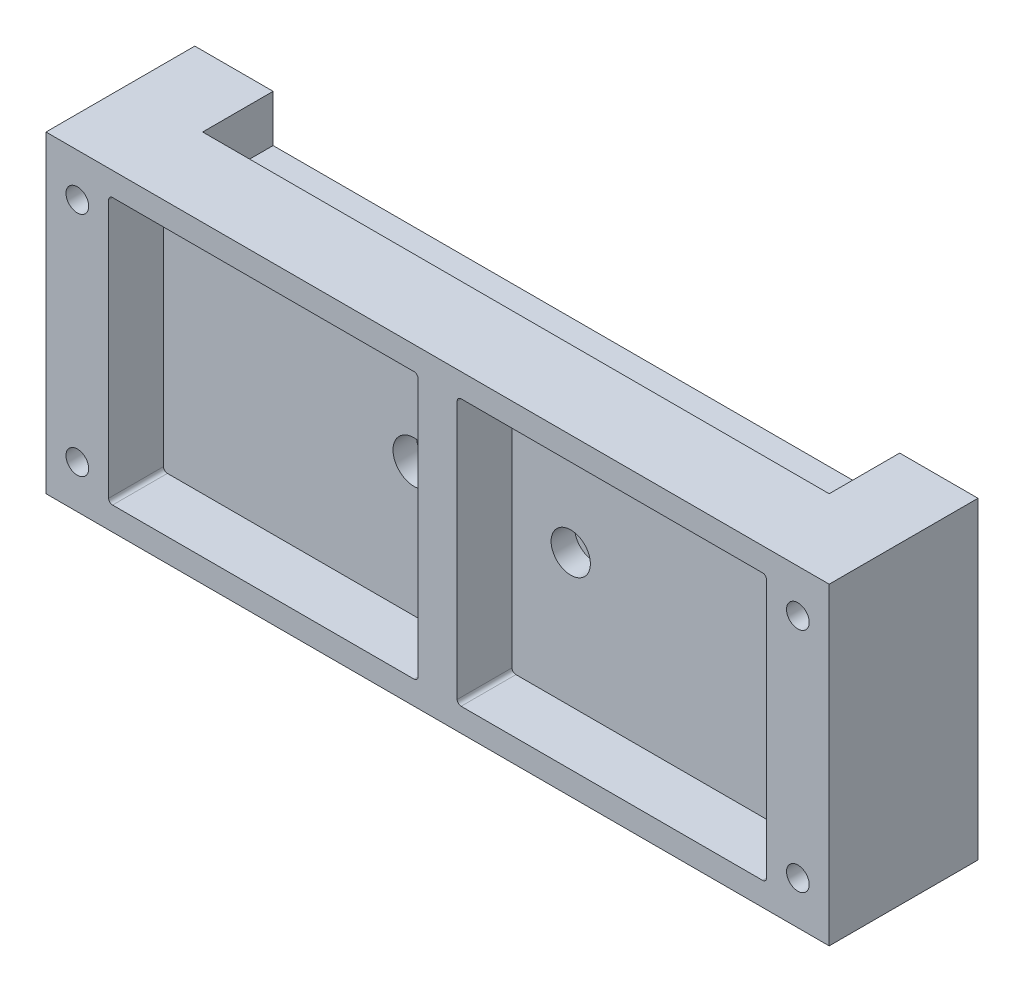
from build123d import *

# Parameters (mm, degrees)
SKETCH1_W           = 100
SKETCH1_H           = 40
BOSS_EXTRUDE1_DEPTH = 38
CUT_EXTRUDE2_START  = -12
SKETCH2_W           = 39.5
SKETCH2_H           = 34
CUT_EXTRUDE2_DEPTH  = 21
CUT_EXTRUDE4_REACH  = 81.36
SKETCH4_R           = 1.45
SKETCH6_W           = 100
SKETCH6_H           = 19
CUT_EXTRUDE5_DEPTH  = 87.215210375
FILLET1_R           = 0.5
CUT_EXTRUDE12_DEPTH = 9
CUT_EXTRUDE13_REACH = 72.385
SKETCH18_R          = 2.506862912
SKETCH18_R_2        = 2.693115416
SKETCH19_R          = 6.477
SKETCH19_R_2        = 4.572
CUT_EXTRUDE14_DEPTH = 0.79375
SKETCH21_W          = 10
SKETCH21_H          = 15
CUT_EXTRUDE15_DEPTH = 9
SKETCH22_W          = 4
SKETCH22_H          = 2.5
CUT_EXTRUDE16_DEPTH = 90
SKETCH23_W          = 80
SKETCH23_H          = 6
CUT_EXTRUDE17_DEPTH = 9


with BuildPart() as part:
    # Sketch1 → Boss-Extrude1 (new body)
    with BuildSketch(Plane.XY):
        with Locations((16.25, 1.5625)):
            Rectangle(SKETCH1_W, SKETCH1_H)
    extrude(amount=BOSS_EXTRUDE1_DEPTH)

    # Sketch2 → Cut-Extrude2 (cut)
    with BuildSketch(Plane(origin=(0, 0, 0), x_dir=(-1, 0, 0), z_dir=(0, 0, -1)).offset(CUT_EXTRUDE2_START)):
        with Locations((-38.5, 1.5625)):
            Rectangle(SKETCH2_W, SKETCH2_H)
        with Locations((6, 1.5625)):
            Rectangle(SKETCH2_W, SKETCH2_H)
    extrude(amount=-CUT_EXTRUDE2_DEPTH, mode=Mode.SUBTRACT)

    # Sketch4 → Cut-Extrude4 (cut, up to next)
    with BuildSketch(Plane(origin=(0, 0, 0), x_dir=(-1, 0, 0), z_dir=(0, 0, -1)), mode=Mode.PRIVATE) as cut_extrude4_sk1:
        with Locations((-62.25, 16.0625)):
            Circle(SKETCH4_R)
    cut_extrude4_tool1 = extrude(cut_extrude4_sk1.sketch, amount=-CUT_EXTRUDE4_REACH, mode=Mode.PRIVATE) & part.part
    # Sketch4 → Cut-Extrude4 (cut, up to next)
    with BuildSketch(Plane(origin=(0, 0, 0), x_dir=(-1, 0, 0), z_dir=(0, 0, -1)), mode=Mode.PRIVATE) as cut_extrude4_sk2:
        with Locations((-62.25, -12.9375)):
            Circle(SKETCH4_R)
    cut_extrude4_tool2 = extrude(cut_extrude4_sk2.sketch, amount=-CUT_EXTRUDE4_REACH, mode=Mode.PRIVATE) & part.part
    # Sketch4 → Cut-Extrude4 (cut, up to next)
    with BuildSketch(Plane(origin=(0, 0, 0), x_dir=(-1, 0, 0), z_dir=(0, 0, -1)), mode=Mode.PRIVATE) as cut_extrude4_sk3:
        with Locations((29.75, 16.0625)):
            Circle(SKETCH4_R)
    cut_extrude4_tool3 = extrude(cut_extrude4_sk3.sketch, amount=-CUT_EXTRUDE4_REACH, mode=Mode.PRIVATE) & part.part
    # Sketch4 → Cut-Extrude4 (cut, up to next)
    with BuildSketch(Plane(origin=(0, 0, 0), x_dir=(-1, 0, 0), z_dir=(0, 0, -1)), mode=Mode.PRIVATE) as cut_extrude4_sk4:
        with Locations((29.75, -12.9375)):
            Circle(SKETCH4_R)
    cut_extrude4_tool4 = extrude(cut_extrude4_sk4.sketch, amount=-CUT_EXTRUDE4_REACH, mode=Mode.PRIVATE) & part.part
    add(cut_extrude4_tool1.solids().sort_by_distance((62.25, 16.0625, 0))[0], mode=Mode.SUBTRACT)
    add(cut_extrude4_tool2.solids().sort_by_distance((62.25, -12.9375, 0))[0], mode=Mode.SUBTRACT)
    add(cut_extrude4_tool3.solids().sort_by_distance((-29.75, 16.0625, 0))[0], mode=Mode.SUBTRACT)
    add(cut_extrude4_tool4.solids().sort_by_distance((-29.75, -12.9375, 0))[0], mode=Mode.SUBTRACT)

    # Sketch6 → Cut-Extrude5 (cut, through all)
    with BuildSketch(Plane(origin=(0, 21.5625, 0), x_dir=(1, 0, 0), z_dir=(0, 1, 0))):
        with Locations((16.25, -28.5)):
            Rectangle(SKETCH6_W, SKETCH6_H)
    extrude(amount=-CUT_EXTRUDE5_DEPTH, mode=Mode.SUBTRACT)

    # Fillet1
    fillet1_edges = [part.edges().sort_by_distance(p)[0] for p in [
        (-25.75, -15.4375, 15.5),
        (13.75, -15.4375, 15.5),
        (-25.75, 18.5625, 15.5),
        (13.75, 18.5625, 15.5),
        (18.75, -15.4375, 15.5),
        (58.25, -15.4375, 15.5),
        (18.75, 18.5625, 15.5),
        (58.25, 18.5625, 15.5),
    ]]
    fillet(fillet1_edges, radius=FILLET1_R)

    # Sketch17 → Cut-Extrude12 (cut)
    with BuildSketch(Plane(origin=(0, 0, 0), x_dir=(-1, 0, 0), z_dir=(0, 0, -1))):
        with BuildLine():
            Line((-56.25, 9.0625), (23.75, 9.0625))
            ThreePointArc((23.75, 9.0625), (31.25, 1.5625), (23.75, -5.9375))
            Line((23.75, -5.9375), (-56.25, -5.9375))
            ThreePointArc((-56.25, -5.9375), (-63.75, 1.5625), (-56.25, 9.0625))
        make_face()
    extrude(amount=-CUT_EXTRUDE12_DEPTH, mode=Mode.SUBTRACT)

    # Sketch18 → Cut-Extrude13 (cut, up to next)
    with BuildSketch(Plane(origin=(0, 0, 9), x_dir=(-1, 0, 0), z_dir=(0, 0, -1)), mode=Mode.PRIVATE) as cut_extrude13_sk1:
        with Locations((-26.25, 1.5625)):
            Circle(SKETCH18_R)
    cut_extrude13_tool1 = extrude(cut_extrude13_sk1.sketch, amount=-CUT_EXTRUDE13_REACH, mode=Mode.PRIVATE) & part.part
    # Sketch18 → Cut-Extrude13 (cut, up to next)
    with BuildSketch(Plane(origin=(0, 0, 9), x_dir=(-1, 0, 0), z_dir=(0, 0, -1)), mode=Mode.PRIVATE) as cut_extrude13_sk2:
        with Locations((-6.25, 1.5625)):
            Circle(SKETCH18_R_2)
    cut_extrude13_tool2 = extrude(cut_extrude13_sk2.sketch, amount=-CUT_EXTRUDE13_REACH, mode=Mode.PRIVATE) & part.part
    add(cut_extrude13_tool1.solids().sort_by_distance((26.25, 1.5625, 9))[0], mode=Mode.SUBTRACT)
    add(cut_extrude13_tool2.solids().sort_by_distance((6.25, 1.5625, 9))[0], mode=Mode.SUBTRACT)

    # Sketch19 → Cut-Extrude14 (cut)
    # profile 1 of 2: a face of its own
    with BuildSketch(Plane(origin=(0, 0, 9), x_dir=(-1, 0, 0), z_dir=(0, 0, -1))):
        with Locations((-26.25, 1.5625)):
            Circle(SKETCH19_R)
        with Locations((-26.25, 1.5625)):
            Circle(SKETCH19_R_2, mode=Mode.SUBTRACT)
    # profile 2 of 2: a face of its own
    with BuildSketch(Plane(origin=(0, 0, 9), x_dir=(-1, 0, 0), z_dir=(0, 0, -1))):
        with Locations((-6.25, 1.5625)):
            Circle(SKETCH19_R)
        with Locations((-6.25, 1.5625)):
            Circle(SKETCH19_R_2, mode=Mode.SUBTRACT)
    extrude(amount=-CUT_EXTRUDE14_DEPTH, mode=Mode.SUBTRACT)

    # Sketch21 → Cut-Extrude15 (cut)
    with BuildSketch(Plane(origin=(0, 0, 0), x_dir=(-1, 0, 0), z_dir=(0, 0, -1))):
        with Locations((28.75, 1.5625)):
            Rectangle(SKETCH21_W, SKETCH21_H)
    extrude(amount=-CUT_EXTRUDE15_DEPTH, mode=Mode.SUBTRACT)

    # Sketch22 → Cut-Extrude16 (cut)
    with BuildSketch(Plane.ZY.offset(33.75)):
        with Locations((4, 10.3125)):
            Rectangle(SKETCH22_W, SKETCH22_H)
        with Locations((4, -7.1875)):
            Rectangle(SKETCH22_W, SKETCH22_H)
    extrude(amount=-CUT_EXTRUDE16_DEPTH, mode=Mode.SUBTRACT)

    # Sketch23 → Cut-Extrude17 (cut)
    with BuildSketch(Plane(origin=(0, 0, 0), x_dir=(-1, 0, 0), z_dir=(0, 0, -1))):
        with Locations((-16.25, 18.5625)):
            Rectangle(SKETCH23_W, SKETCH23_H)
        with Locations((-16.25, -15.4375)):
            Rectangle(SKETCH23_W, SKETCH23_H)
    extrude(amount=-CUT_EXTRUDE17_DEPTH, mode=Mode.SUBTRACT)


solid = part.part
